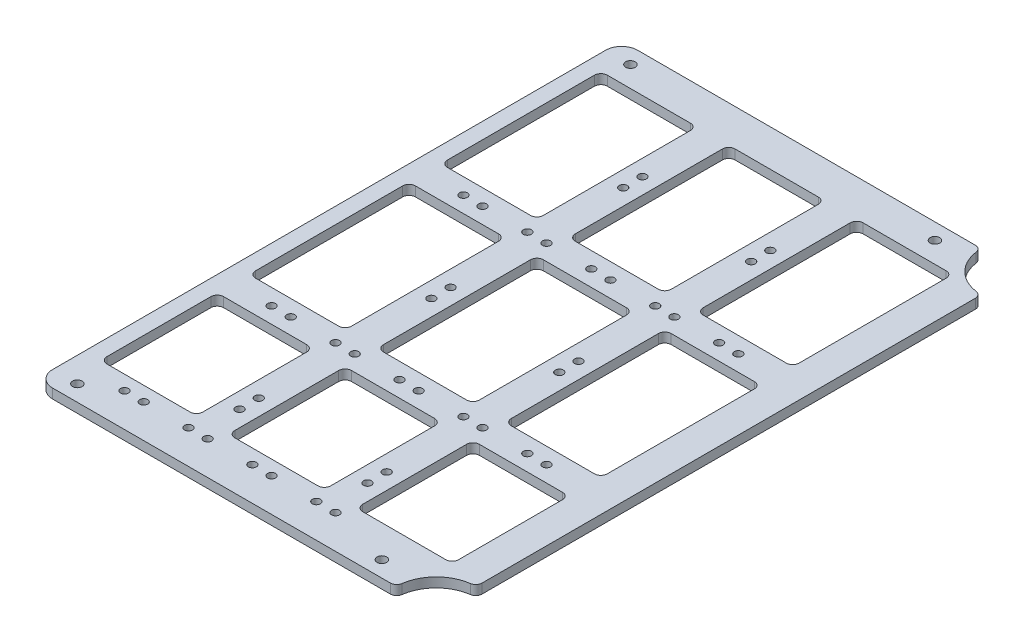
from build123d import *

# Parameters (mm, degrees)
BOSS_EXTRUDE1_DEPTH = 3
CUT_EXTRUDE6_REACH  = 450.997
SKETCH10_R          = 1.5
SKETCH11_W          = 285
SKETCH11_H          = 183
CUT_EXTRUDE7_DEPTH  = 10
FILLET1_R           = 5
SKETCH12_R          = 1.25
CUT_EXTRUDE8_DEPTH  = 3


with BuildPart() as part:
    # Sketch1 → Boss-Extrude1 (new body)
    with BuildSketch(Plane(origin=(0, 0, 0), x_dir=(1, 0, 0), z_dir=(0, 1, 0))):
        with BuildLine():
            Line((0, 14.361406616), (0, 168.638593384))
            ThreePointArc((0, 168.638593384), (0.491403941, 169.951657712), (1.724137931, 170.619477055))
            ThreePointArc((1.724137931, 170.619477055), (8.838834765, 174.161165235), (12.380522945, 181.275862069))
            ThreePointArc((12.380522945, 181.275862069), (13.048342288, 182.508596059), (14.361406616, 183))
            Line((14.361406616, 183), (395.638593384, 183))
            ThreePointArc((395.638593384, 183), (396.951657712, 182.508596059), (397.619477055, 181.275862069))
            ThreePointArc((397.619477055, 181.275862069), (401.161165235, 174.161165235), (408.275862069, 170.619477055))
            ThreePointArc((408.275862069, 170.619477055), (409.508596059, 169.951657712), (410, 168.638593384))
            Line((410, 168.638593384), (410, 14.361406616))
            ThreePointArc((410, 14.361406616), (409.508596059, 13.048342288), (408.275862069, 12.380522945))
            ThreePointArc((408.275862069, 12.380522945), (401.161165235, 8.838834765), (397.619477055, 1.724137931))
            ThreePointArc((397.619477055, 1.724137931), (396.951657712, 0.491403941), (395.638593384, 0))
            Line((395.638593384, 0), (14.361406616, 0))
            ThreePointArc((14.361406616, 0), (13.048342288, 0.491403941), (12.380522945, 1.724137931))
            ThreePointArc((12.380522945, 1.724137931), (8.838834765, 8.838834765), (1.724137931, 12.380522945))
            ThreePointArc((1.724137931, 12.380522945), (0.491403941, 13.048342288), (0, 14.361406616))
        make_face()
    extrude(amount=BOSS_EXTRUDE1_DEPTH)

    # Sketch10 → Cut-Extrude6 (cut, up to next)
    with BuildSketch(Plane(origin=(0, 3, 0), x_dir=(1, 0, 0), z_dir=(0, 1, 0)), mode=Mode.PRIVATE) as cut_extrude6_sk1:
        with Locations(Location((17.5, 178, 0), (0, 0, 270))):
            Circle(SKETCH10_R)
    cut_extrude6_tool1 = extrude(cut_extrude6_sk1.sketch, amount=-CUT_EXTRUDE6_REACH, mode=Mode.PRIVATE) & part.part
    # Sketch10 → Cut-Extrude6 (cut, up to next)
    with BuildSketch(Plane(origin=(0, 3, 0), x_dir=(1, 0, 0), z_dir=(0, 1, 0)), mode=Mode.PRIVATE) as cut_extrude6_sk2:
        with Locations(Location((388, 178, 0), (0, 0, 270))):
            Circle(SKETCH10_R)
    cut_extrude6_tool2 = extrude(cut_extrude6_sk2.sketch, amount=-CUT_EXTRUDE6_REACH, mode=Mode.PRIVATE) & part.part
    # Sketch10 → Cut-Extrude6 (cut, up to next)
    with BuildSketch(Plane(origin=(0, 3, 0), x_dir=(1, 0, 0), z_dir=(0, 1, 0)), mode=Mode.PRIVATE) as cut_extrude6_sk3:
        with Locations(Location((388, 5, 0), (0, 0, 270))):
            Circle(SKETCH10_R)
    cut_extrude6_tool3 = extrude(cut_extrude6_sk3.sketch, amount=-CUT_EXTRUDE6_REACH, mode=Mode.PRIVATE) & part.part
    # Sketch10 → Cut-Extrude6 (cut, up to next)
    with BuildSketch(Plane(origin=(0, 3, 0), x_dir=(1, 0, 0), z_dir=(0, 1, 0)), mode=Mode.PRIVATE) as cut_extrude6_sk4:
        with Locations(Location((17.5, 5, 0), (0, 0, 270))):
            Circle(SKETCH10_R)
    cut_extrude6_tool4 = extrude(cut_extrude6_sk4.sketch, amount=-CUT_EXTRUDE6_REACH, mode=Mode.PRIVATE) & part.part
    # Sketch10 → Cut-Extrude6 (cut, up to next)
    with BuildSketch(Plane(origin=(0, 3, 0), x_dir=(1, 0, 0), z_dir=(0, 1, 0)), mode=Mode.PRIVATE) as cut_extrude6_sk5:
        with Locations(Location((202.75, 178, 0), (0, 0, 270))):
            Circle(SKETCH10_R)
    cut_extrude6_tool5 = extrude(cut_extrude6_sk5.sketch, amount=-CUT_EXTRUDE6_REACH, mode=Mode.PRIVATE) & part.part
    # Sketch10 → Cut-Extrude6 (cut, up to next)
    with BuildSketch(Plane(origin=(0, 3, 0), x_dir=(1, 0, 0), z_dir=(0, 1, 0)), mode=Mode.PRIVATE) as cut_extrude6_sk6:
        with Locations(Location((202.75, 5, 0), (0, 0, 270))):
            Circle(SKETCH10_R)
    cut_extrude6_tool6 = extrude(cut_extrude6_sk6.sketch, amount=-CUT_EXTRUDE6_REACH, mode=Mode.PRIVATE) & part.part
    # Sketch10 → Cut-Extrude6 (cut, up to next)
    with BuildSketch(Plane(origin=(0, 3, 0), x_dir=(1, 0, 0), z_dir=(0, 1, 0)), mode=Mode.PRIVATE) as cut_extrude6_sk7:
        with Locations(Location((292.75, 178, 0), (0, 0, 270))):
            Circle(SKETCH10_R)
    cut_extrude6_tool7 = extrude(cut_extrude6_sk7.sketch, amount=-CUT_EXTRUDE6_REACH, mode=Mode.PRIVATE) & part.part
    # Sketch10 → Cut-Extrude6 (cut, up to next)
    with BuildSketch(Plane(origin=(0, 3, 0), x_dir=(1, 0, 0), z_dir=(0, 1, 0)), mode=Mode.PRIVATE) as cut_extrude6_sk8:
        with Locations(Location((292.75, 5, 0), (0, 0, 270))):
            Circle(SKETCH10_R)
    cut_extrude6_tool8 = extrude(cut_extrude6_sk8.sketch, amount=-CUT_EXTRUDE6_REACH, mode=Mode.PRIVATE) & part.part
    add(cut_extrude6_tool1.solids().sort_by_distance((17.5, 3, -178))[0], mode=Mode.SUBTRACT)
    add(cut_extrude6_tool2.solids().sort_by_distance((388, 3, -178))[0], mode=Mode.SUBTRACT)
    add(cut_extrude6_tool3.solids().sort_by_distance((388, 3, -5))[0], mode=Mode.SUBTRACT)
    add(cut_extrude6_tool4.solids().sort_by_distance((17.5, 3, -5))[0], mode=Mode.SUBTRACT)
    add(cut_extrude6_tool5.solids().sort_by_distance((202.75, 3, -178))[0], mode=Mode.SUBTRACT)
    add(cut_extrude6_tool6.solids().sort_by_distance((202.75, 3, -5))[0], mode=Mode.SUBTRACT)
    add(cut_extrude6_tool7.solids().sort_by_distance((292.75, 3, -178))[0], mode=Mode.SUBTRACT)
    add(cut_extrude6_tool8.solids().sort_by_distance((292.75, 3, -5))[0], mode=Mode.SUBTRACT)

    # Sketch11 → Cut-Extrude7 (cut)
    with BuildSketch(Plane(origin=(0, 3, 0), x_dir=(1, 0, 0), z_dir=(0, 1, 0))):
        with Locations((142.5, 91.5)):
            Rectangle(SKETCH11_W, SKETCH11_H)
    extrude(amount=-CUT_EXTRUDE7_DEPTH, mode=Mode.SUBTRACT)

    # Fillet1
    fillet1_edges = [part.edges().sort_by_distance(p)[0] for p in [
        (285, 1.5, -183),
        (285, 1.5, 0),
    ]]
    fillet(fillet1_edges, radius=FILLET1_R)

    # Sketch12 → Cut-Extrude8 (cut)
    with BuildSketch(Plane(origin=(0, 3, 0), x_dir=(1, 0, 0), z_dir=(0, 1, 0))):
        with Locations(Location((325, 149.5, 0), (0, 0, 270))):
            Circle(SKETCH12_R)
        with Locations(Location((325, 143.5, 0), (0, 0, 270))):
            Circle(SKETCH12_R)
        with Locations(Location((365, 149.5, 0), (0, 0, 270))):
            Circle(SKETCH12_R)
        with Locations(Location((365, 143.5, 0), (0, 0, 270))):
            Circle(SKETCH12_R)
        with Locations(Location((325, 89.5, 0), (0, 0, 270))):
            Circle(SKETCH12_R)
        with Locations(Location((325, 83.5, 0), (0, 0, 270))):
            Circle(SKETCH12_R)
        with Locations(Location((365, 89.5, 0), (0, 0, 270))):
            Circle(SKETCH12_R)
        with Locations(Location((365, 83.5, 0), (0, 0, 270))):
            Circle(SKETCH12_R)
        with Locations(Location((325, 29.5, 0), (0, 0, 270))):
            Circle(SKETCH12_R)
        with Locations(Location((325, 23.5, 0), (0, 0, 270))):
            Circle(SKETCH12_R)
        with Locations(Location((365, 29.5, 0), (0, 0, 270))):
            Circle(SKETCH12_R)
        with Locations(Location((365, 23.5, 0), (0, 0, 270))):
            Circle(SKETCH12_R)
        with Locations(Location((302, 116.5, 0), (0, 0, 270))):
            Circle(SKETCH12_R)
        with Locations(Location((308, 116.5, 0), (0, 0, 270))):
            Circle(SKETCH12_R)
        with Locations(Location((322, 116.5, 0), (0, 0, 270))):
            Circle(SKETCH12_R)
        with Locations(Location((328, 116.5, 0), (0, 0, 270))):
            Circle(SKETCH12_R)
        with Locations(Location((342, 116.5, 0), (0, 0, 270))):
            Circle(SKETCH12_R)
        with Locations(Location((348, 116.5, 0), (0, 0, 270))):
            Circle(SKETCH12_R)
        with Locations(Location((362, 116.5, 0), (0, 0, 270))):
            Circle(SKETCH12_R)
        with Locations(Location((368, 116.5, 0), (0, 0, 270))):
            Circle(SKETCH12_R)
        with Locations(Location((382, 116.5, 0), (0, 0, 270))):
            Circle(SKETCH12_R)
        with Locations(Location((388, 116.5, 0), (0, 0, 270))):
            Circle(SKETCH12_R)
        with Locations(Location((302, 56.5, 0), (0, 0, 270))):
            Circle(SKETCH12_R)
        with Locations(Location((308, 56.5, 0), (0, 0, 270))):
            Circle(SKETCH12_R)
        with Locations(Location((322, 56.5, 0), (0, 0, 270))):
            Circle(SKETCH12_R)
        with Locations(Location((328, 56.5, 0), (0, 0, 270))):
            Circle(SKETCH12_R)
        with Locations(Location((342, 56.5, 0), (0, 0, 270))):
            Circle(SKETCH12_R)
        with Locations(Location((348, 56.5, 0), (0, 0, 270))):
            Circle(SKETCH12_R)
        with Locations(Location((362, 56.5, 0), (0, 0, 270))):
            Circle(SKETCH12_R)
        with Locations(Location((368, 56.5, 0), (0, 0, 270))):
            Circle(SKETCH12_R)
        with Locations(Location((382, 56.5, 0), (0, 0, 270))):
            Circle(SKETCH12_R)
        with Locations(Location((388, 56.5, 0), (0, 0, 270))):
            Circle(SKETCH12_R)
        with Locations(Location((302, 10.5, 0), (0, 0, 270))):
            Circle(SKETCH12_R)
        with Locations(Location((308, 10.5, 0), (0, 0, 270))):
            Circle(SKETCH12_R)
        with Locations(Location((322, 10.5, 0), (0, 0, 270))):
            Circle(SKETCH12_R)
        with Locations(Location((328, 10.5, 0), (0, 0, 270))):
            Circle(SKETCH12_R)
        with Locations(Location((342, 10.5, 0), (0, 0, 270))):
            Circle(SKETCH12_R)
        with Locations(Location((348, 10.5, 0), (0, 0, 270))):
            Circle(SKETCH12_R)
        with Locations(Location((362, 10.5, 0), (0, 0, 270))):
            Circle(SKETCH12_R)
        with Locations(Location((368, 10.5, 0), (0, 0, 270))):
            Circle(SKETCH12_R)
        with BuildLine():
            Line((332, 121.5), (358, 121.5))
            ThreePointArc((358, 121.5), (359.414213562, 122.085786438), (360, 123.5))
            Line((360, 123.5), (360, 169.5))
            ThreePointArc((360, 169.5), (359.414213562, 170.914213562), (358, 171.5))
            Line((358, 171.5), (332, 171.5))
            ThreePointArc((332, 171.5), (330.585786438, 170.914213562), (330, 169.5))
            Line((330, 169.5), (330, 123.5))
            ThreePointArc((330, 123.5), (330.585786438, 122.085786438), (332, 121.5))
        make_face()
        with BuildLine():
            Line((292, 171.5), (318, 171.5))
            ThreePointArc((318, 171.5), (319.414213562, 170.914213562), (320, 169.5))
            Line((320, 169.5), (320, 123.5))
            ThreePointArc((320, 123.5), (319.414213562, 122.085786438), (318, 121.5))
            Line((318, 121.5), (292, 121.5))
            ThreePointArc((292, 121.5), (290.585786438, 122.085786438), (290, 123.5))
            Line((290, 123.5), (290, 169.5))
            ThreePointArc((290, 169.5), (290.585786438, 170.914213562), (292, 171.5))
        make_face()
        with BuildLine():
            Line((372, 121.5), (398, 121.5))
            ThreePointArc((398, 121.5), (399.414213562, 122.085786438), (400, 123.5))
            Line((400, 123.5), (400, 169.5))
            ThreePointArc((400, 169.5), (399.414213562, 170.914213562), (398, 171.5))
            Line((398, 171.5), (372, 171.5))
            ThreePointArc((372, 171.5), (370.585786438, 170.914213562), (370, 169.5))
            Line((370, 169.5), (370, 123.5))
            ThreePointArc((370, 123.5), (370.585786438, 122.085786438), (372, 121.5))
        make_face()
        with BuildLine():
            Line((332, 61.5), (358, 61.5))
            ThreePointArc((358, 61.5), (359.414213562, 62.085786438), (360, 63.5))
            Line((360, 63.5), (360, 109.5))
            ThreePointArc((360, 109.5), (359.414213562, 110.914213562), (358, 111.5))
            Line((358, 111.5), (332, 111.5))
            ThreePointArc((332, 111.5), (330.585786438, 110.914213562), (330, 109.5))
            Line((330, 109.5), (330, 63.5))
            ThreePointArc((330, 63.5), (330.585786438, 62.085786438), (332, 61.5))
        make_face()
        with BuildLine():
            Line((292, 111.5), (318, 111.5))
            ThreePointArc((318, 111.5), (319.414213562, 110.914213562), (320, 109.5))
            Line((320, 109.5), (320, 63.5))
            ThreePointArc((320, 63.5), (319.414213562, 62.085786438), (318, 61.5))
            Line((318, 61.5), (292, 61.5))
            ThreePointArc((292, 61.5), (290.585786438, 62.085786438), (290, 63.5))
            Line((290, 63.5), (290, 109.5))
            ThreePointArc((290, 109.5), (290.585786438, 110.914213562), (292, 111.5))
        make_face()
        with BuildLine():
            Line((372, 61.5), (398, 61.5))
            ThreePointArc((398, 61.5), (399.414213562, 62.085786438), (400, 63.5))
            Line((400, 63.5), (400, 109.5))
            ThreePointArc((400, 109.5), (399.414213562, 110.914213562), (398, 111.5))
            Line((398, 111.5), (372, 111.5))
            ThreePointArc((372, 111.5), (370.585786438, 110.914213562), (370, 109.5))
            Line((370, 109.5), (370, 63.5))
            ThreePointArc((370, 63.5), (370.585786438, 62.085786438), (372, 61.5))
        make_face()
        with BuildLine():
            Line((292, 51.5), (318, 51.5))
            ThreePointArc((318, 51.5), (319.414213562, 50.914213562), (320, 49.5))
            Line((320, 49.5), (320, 17))
            ThreePointArc((320, 17), (319.414213562, 15.585786438), (318, 15))
            Line((318, 15), (292, 15))
            ThreePointArc((292, 15), (290.585786438, 15.585786438), (290, 17))
            Line((290, 17), (290, 49.5))
            ThreePointArc((290, 49.5), (290.585786438, 50.914213562), (292, 51.5))
        make_face()
        with BuildLine():
            Line((360, 49.5), (360, 17))
            ThreePointArc((360, 17), (359.414213562, 15.585786438), (358, 15))
            Line((358, 15), (332, 15))
            ThreePointArc((332, 15), (330.585786438, 15.585786438), (330, 17))
            Line((330, 17), (330, 49.5))
            ThreePointArc((330, 49.5), (330.585786438, 50.914213562), (332, 51.5))
            Line((332, 51.5), (358, 51.5))
            ThreePointArc((358, 51.5), (359.414213562, 50.914213562), (360, 49.5))
        make_face()
        with BuildLine():
            Line((400, 49.5), (400, 17))
            ThreePointArc((400, 17), (399.414213562, 15.585786438), (398, 15))
            Line((398, 15), (372, 15))
            ThreePointArc((372, 15), (370.585786438, 15.585786438), (370, 17))
            Line((370, 17), (370, 49.5))
            ThreePointArc((370, 49.5), (370.585786438, 50.914213562), (372, 51.5))
            Line((372, 51.5), (398, 51.5))
            ThreePointArc((398, 51.5), (399.414213562, 50.914213562), (400, 49.5))
        make_face()
    extrude(amount=-CUT_EXTRUDE8_DEPTH, mode=Mode.SUBTRACT)


solid = part.part
